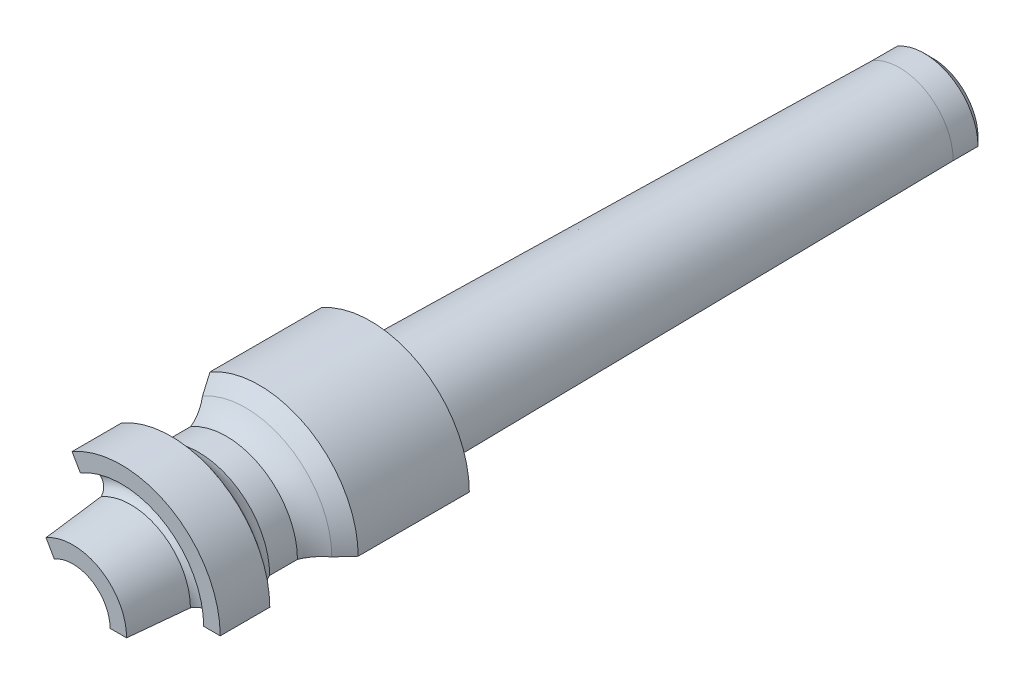
from build123d import *

# Parameters (mm, degrees)
REVOLVE_1_ANGLE = 120
REVOLVE_2_ANGLE = 120
FILLET_27_R     = 2
EXTRUDE_1_DEPTH = 2
CHAMFER_1_SIZE  = 0.5


with BuildPart() as part:
    # 스케치1 → 회전1 (revolve)
    with BuildSketch(Plane(origin=(0, 0, 0), x_dir=(1, 0, 0), z_dir=(0, 1, 0))):
        with BuildLine():
            Line((2.25, 0), (2.25, -50))
            Line((2.25, -50), (3.25, -50))
            Line((3.25, -50), (3.603114983, -46.49452211))
            ThreePointArc((3.603114983, -46.49452211), (4.042757009, -46.130564651), (4.606175885, -46.221720081))
            Line((4.606175885, -46.221720081), (4.975, -47.062556114))
            Line((4.975, -47.062556114), (5.975, -47.062556114))
            Line((5.975, -47.062556114), (5.975, -44.062556114))
            Line((5.975, -44.062556114), (5.078278936, -43.393691147))
            ThreePointArc((5.078278936, -43.393691147), (4.624731294, -42.949092522), (4.305722667, -42.399905035))
            Line((4.305722667, -42.399905035), (4.305722667, -40.721385))
            ThreePointArc((4.305722667, -40.721385), (4.679223869, -40.074079017), (5.213640074, -39.551673521))
            Line((5.213640074, -39.551673521), (5.975, -38.717465797))
            Line((5.975, -38.717465797), (5.975, -31.993443693))
            Line((5.975, -31.993443693), (5.332284525, -31.993443693))
            ThreePointArc((5.332284525, -31.993443693), (5.194049194, -34.352235197), (4.750405575, -36.673051153))
            ThreePointArc((4.750405575, -36.673051153), (4.308822268, -37.118380872), (3.859857213, -36.68049418))
            Line((3.859857213, -36.68049418), (3.25, 0))
            Line((3.25, 0), (2.25, 0))
        make_face()
    revolve(axis=Axis((0, 0, 0), (0, 0, 1)), revolution_arc=REVOLVE_1_ANGLE)

    # 스케치3 → 회전2 (revolve)
    with BuildSketch(Plane(origin=(0, 0, 0), x_dir=(1, 0, 0), z_dir=(0, 1, 0))):
        Polygon((1.86, -1), (2.25, -2), (2.25, 0), align=None)
        Polygon((1.86, -3), (2.25, -4), (2.25, -2), align=None)
        Polygon((1.86, -5), (2.25, -6), (2.25, -4), align=None)
        Polygon((1.86, -49), (2.25, -50), (2.25, -48), align=None)
        Polygon((1.86, -7), (2.25, -8), (2.25, -6), align=None)
        Polygon((2.25, -10), (2.25, -8), (1.86, -9), align=None)
        Polygon((2.25, -12), (2.25, -10), (1.86, -11), align=None)
        Polygon((2.25, -14), (2.25, -12), (1.86, -13), align=None)
        Polygon((2.25, -16), (2.25, -14), (1.86, -15), align=None)
        Polygon((2.25, -18), (2.25, -16), (1.86, -17), align=None)
        Polygon((2.25, -20), (2.25, -18), (1.86, -19), align=None)
        Polygon((1.86, -21), (2.25, -22), (2.25, -20), align=None)
        Polygon((2.25, -24), (2.25, -22), (1.86, -23), align=None)
        Polygon((2.25, -24), (1.86, -25), (2.25, -26), align=None)
        Polygon((2.25, -28), (2.25, -26), (1.86, -27), align=None)
        Polygon((2.25, -30), (2.25, -28), (1.86, -29), align=None)
        Polygon((2.25, -32), (2.25, -30), (1.86, -31), align=None)
        Polygon((2.25, -32), (1.86, -33), (2.25, -34), align=None)
        Polygon((2.25, -34), (1.86, -35), (2.25, -36), align=None)
        Polygon((2.25, -36), (1.86, -37), (2.25, -38), align=None)
        Polygon((1.86, -39), (2.25, -40), (2.25, -38), align=None)
        Polygon((1.86, -41), (2.25, -42), (2.25, -40), align=None)
        Polygon((2.25, -44), (2.25, -42), (1.86, -43), align=None)
        Polygon((2.25, -46), (2.25, -44), (1.86, -45), align=None)
        Polygon((2.25, -48), (2.25, -46), (1.86, -47), align=None)
    revolve(axis=Axis((0, 0, 0), (0, 0, 1)), revolution_arc=REVOLVE_2_ANGLE)

    # 필렛27
    fillet_27_edges = [part.edges().sort_by_distance(p)[0] for p in [
        (0.93, 1.610807251, 35),
        (0.93, 1.610807251, 37),
        (0.93, 1.610807251, 39),
        (0.93, 1.610807251, 41),
        (0.93, 1.610807251, 43),
        (0.93, 1.610807251, 45),
        (0.93, 1.610807251, 47),
        (0.93, 1.610807251, 49),
        (0.93, 1.610807251, 1),
        (0.93, 1.610807251, 3),
        (0.93, 1.610807251, 5),
        (0.93, 1.610807251, 7),
        (0.93, 1.610807251, 9),
        (0.93, 1.610807251, 11),
        (0.93, 1.610807251, 13),
        (0.93, 1.610807251, 15),
        (0.93, 1.610807251, 17),
        (0.93, 1.610807251, 19),
        (0.93, 1.610807251, 21),
        (0.93, 1.610807251, 23),
        (0.93, 1.610807251, 25),
        (0.93, 1.610807251, 27),
        (0.93, 1.610807251, 29),
        (0.93, 1.610807251, 31),
        (0.93, 1.610807251, 33),
    ]]
    fillet(fillet_27_edges, radius=FILLET_27_R)

    # 스케치5 → 보스-돌출1 (add)
    with BuildSketch(Plane(origin=(0, 0, 0), x_dir=(-1, 0, 0), z_dir=(0, 0, -1))):
        with BuildLine():
            Line((1.125, 1.948557159), (1.625, 2.814582562))
            ThreePointArc((1.625, 2.814582562), (-1.625, 2.814582562), (-3.25, 0))
            Line((-3.25, 0), (-2.25, 0))
            ThreePointArc((-2.25, 0), (-1.125, 1.948557159), (1.125, 1.948557159))
        make_face()
    extrude(amount=EXTRUDE_1_DEPTH)

    # 모따기1
    chamfer_1_edges = [part.edges().sort_by_distance(p)[0] for p in [
        (1.625, 2.814582562, -2),
    ]]
    chamfer(chamfer_1_edges, length=CHAMFER_1_SIZE)


solid = part.part
